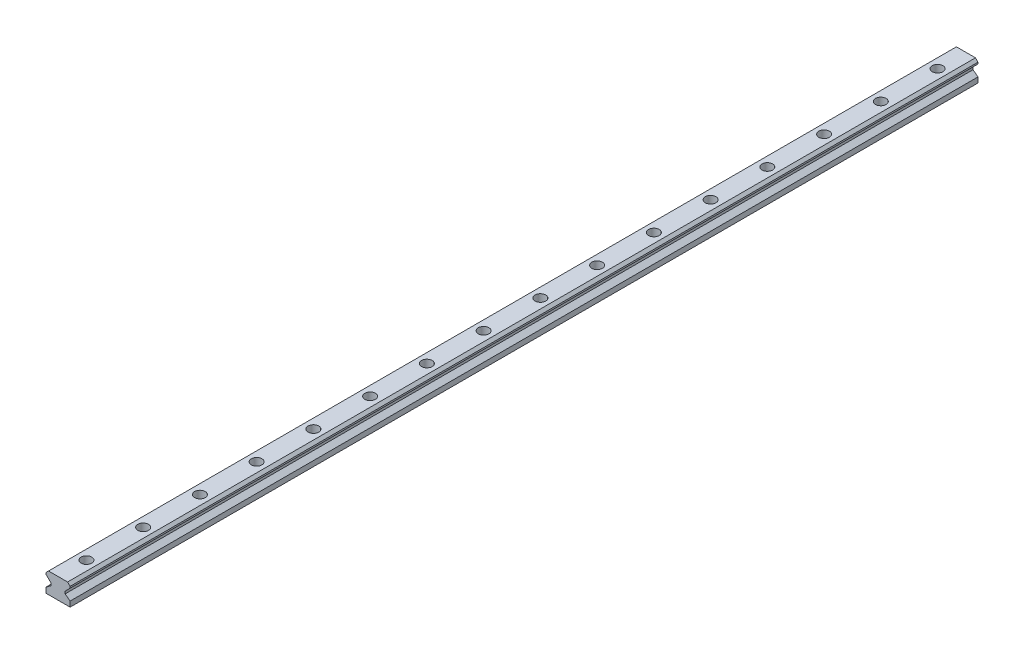
from build123d import *

# Parameters (mm, degrees)
EXTRUDE_1_DEPTH              = 640
HOLE_WIZARD_M8_1_D           = 9
HOLE_WIZARD_M8_1_CBORE_D     = 15
HOLE_WIZARD_M8_1_CBORE_DEPTH = 12
PATTERN_LINEAR_1_COUNT       = 16
PATTERN_LINEAR_1_PITCH       = 80


with BuildPart() as part:
    # 草圖1 → 伸長1 (new, symmetric)
    with BuildSketch(Plane.XY):
        Polygon((17, 0), (-17, 0), (-17, 7.5), (-10, 12.721375014), (-10, 16.129907798), (-17, 23.129907798), (-17, 25.4259063), (-13.4259063, 29), (13.4259063, 29), (17, 25.4259063), (17, 23.129907798), (10, 16.129907798), (10, 12.721375014), (17, 7.5), align=None)
    extrude(amount=EXTRUDE_1_DEPTH, both=True)

    # M8 內六角圓柱頭螺釘的柱孔1 (through all)
    with Locations(Plane(origin=(0, 29, 0), x_dir=(-1, 0, 0), z_dir=(0, 1, 0))):
        with Locations((0, -600)):
            hole_wizard_m8_1 = CounterBoreHole(HOLE_WIZARD_M8_1_D / 2, HOLE_WIZARD_M8_1_CBORE_D / 2, HOLE_WIZARD_M8_1_CBORE_DEPTH)

    # 直線複製排列1: M8 內六角圓柱頭螺釘的柱孔1 ×16
    with Locations(*[(0, 0, i * PATTERN_LINEAR_1_PITCH) for i in range(1, PATTERN_LINEAR_1_COUNT)]):
        add(hole_wizard_m8_1, mode=Mode.SUBTRACT)


solid = part.part
